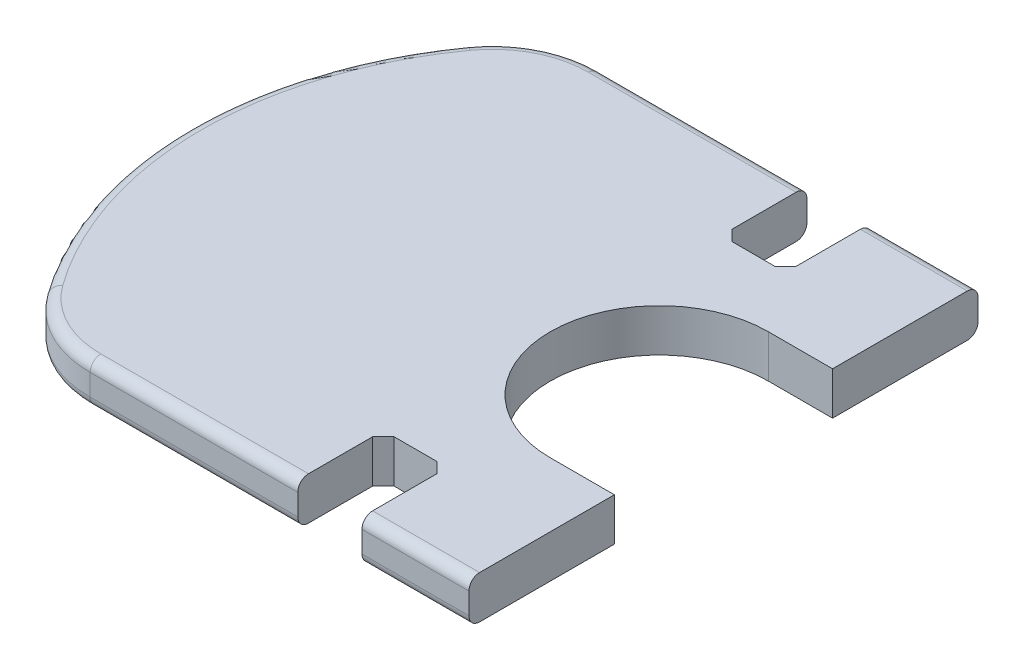
from build123d import *

# Parameters (mm, degrees)
BOSS_EXTRUDE1_DEPTH = 2
FILLET2_R           = 5
FILLET1_R           = 0.5
SKETCH2_W           = 3
SKETCH2_H           = 7
CUT_EXTRUDE1_DEPTH  = 10
CHAMFER1_SIZE       = 0.5


with BuildPart() as part:
    # Sketch1 → Boss-Extrude1 (new body)
    with BuildSketch(Plane(origin=(0, 0, 0), x_dir=(1, 0, 0), z_dir=(0, 1, 0))):
        with BuildLine():
            Line((0, 5.1), (3, 5.1))
            Line((3, 5.1), (3, 11.9))
            Line((3, 11.9), (-17, 11.9))
            ThreePointArc((-17, 11.9), (-21.929141392, 0), (-17, -11.9))
            Line((-17, -11.9), (3, -11.9))
            Line((3, -11.9), (3, -5.1))
            Line((3, -5.1), (0, -5.1))
            ThreePointArc((0, -5.1), (-5.1, 0), (0, 5.1))
        make_face()
    extrude(amount=BOSS_EXTRUDE1_DEPTH)

    # Fillet2
    fillet2_edges = [part.edges().sort_by_distance(p)[0] for p in [
        (-17, 1, 11.9),
        (-17, 1, -11.9),
    ]]
    fillet(fillet2_edges, radius=FILLET2_R)

    # Fillet1
    fillet1_edges = [part.edges().sort_by_distance(p)[0] for p in [
        (-5.854128071, 2, -11.9),
        (-5.854128071, 0, 11.9),
        (-5.854128071, 2, 11.9),
        (-21.929141392, 0, 0),
        (-16.990510437, 0, -11.348743118),
        (-16.990510437, 0, 11.348743118),
        (-21.929141392, 2, 0),
        (-16.990510437, 2, -11.348743118),
        (-16.990510437, 2, 11.348743118),
        (-5.854128071, 0, -11.9),
    ]]
    fillet(fillet1_edges, radius=FILLET1_R)

    # Sketch2 → Cut-Extrude1 (cut)
    with BuildSketch(Plane(origin=(0, 2, 0), x_dir=(1, 0, 0), z_dir=(0, 1, 0))):
        with Locations((-3.5, 11.4)):
            Rectangle(SKETCH2_W, SKETCH2_H)
        with Locations((-3.5, -11.4)):
            Rectangle(SKETCH2_W, SKETCH2_H)
    extrude(amount=-CUT_EXTRUDE1_DEPTH, mode=Mode.SUBTRACT)

    # Chamfer1
    chamfer1_edges = [part.edges().sort_by_distance(p)[0] for p in [
        (-2, 1, -7.9),
        (-5, 1, -7.9),
        (-5, 1, 7.9),
        (-2, 1, 7.9),
    ]]
    chamfer(chamfer1_edges, length=CHAMFER1_SIZE)


solid = part.part
